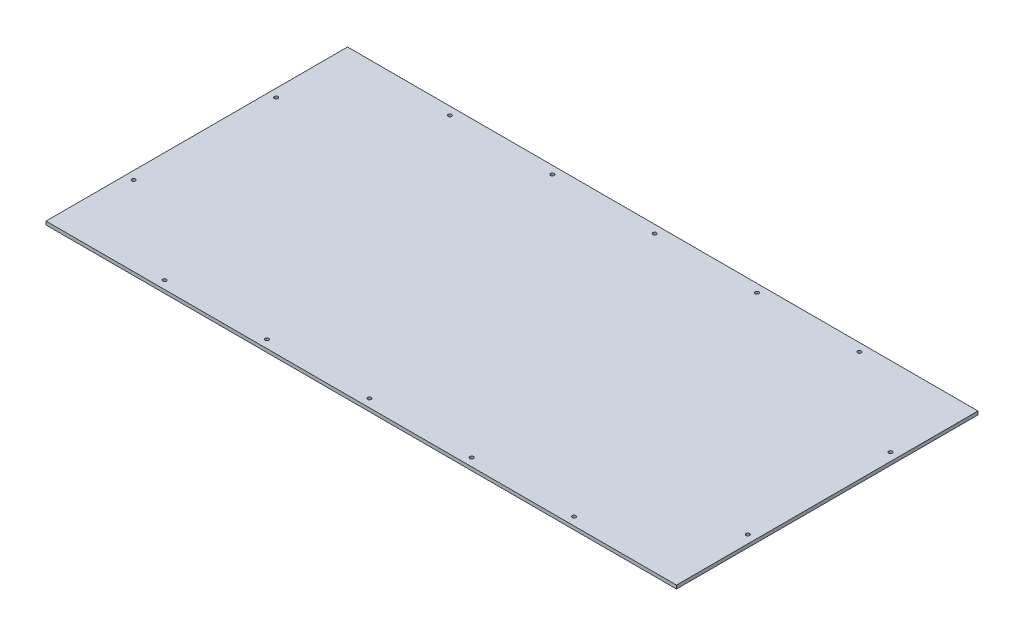
from build123d import *

# Parameters (mm, degrees)
SKETCH1_W           = 584.2
SKETCH1_H           = 279.4
SKETCH1_R           = 1.65
BOSS_EXTRUDE1_DEPTH = 3.175


with BuildPart() as part:
    # Sketch1 → Boss-Extrude1 (new body)
    with BuildSketch(Plane(origin=(0, 0, 0), x_dir=(1, 0, 0), z_dir=(0, 1, 0))):
        Rectangle(SKETCH1_W, SKETCH1_H)
        with Locations(Location((-284.6, 66.1, 0), (0, 0, 270))):
            Circle(SKETCH1_R, mode=Mode.SUBTRACT)
        with Locations(Location((-189.733333333, 132.2, 0), (0, 0, 270))):
            Circle(SKETCH1_R, mode=Mode.SUBTRACT)
        with Locations(Location((-94.866666667, 132.2, 0), (0, 0, 270))):
            Circle(SKETCH1_R, mode=Mode.SUBTRACT)
        with Locations(Location((-284.6, -66.1, 0), (0, 0, 90))):
            Circle(SKETCH1_R, mode=Mode.SUBTRACT)
        with Locations(Location((-94.866666667, -132.2, 0), (0, 0, 90))):
            Circle(SKETCH1_R, mode=Mode.SUBTRACT)
        with Locations(Location((-189.733333333, -132.2, 0), (0, 0, 90))):
            Circle(SKETCH1_R, mode=Mode.SUBTRACT)
        with Locations(Location((189.733333333, -132.2, 0), (0, 0, 270))):
            Circle(SKETCH1_R, mode=Mode.SUBTRACT)
        with Locations(Location((94.866666667, -132.2, 0), (0, 0, 270))):
            Circle(SKETCH1_R, mode=Mode.SUBTRACT)
        with Locations(Location((94.866666667, 132.2, 0), (0, 0, 90))):
            Circle(SKETCH1_R, mode=Mode.SUBTRACT)
        with Locations(Location((189.733333333, 132.2, 0), (0, 0, 90))):
            Circle(SKETCH1_R, mode=Mode.SUBTRACT)
        with Locations(Location((284.6, -66.1, 0), (0, 0, 270))):
            Circle(SKETCH1_R, mode=Mode.SUBTRACT)
        with Locations(Location((284.6, 66.1, 0), (0, 0, 90))):
            Circle(SKETCH1_R, mode=Mode.SUBTRACT)
        with Locations(Location((0, 132.2, 0), (0, 0, 270))):
            Circle(SKETCH1_R, mode=Mode.SUBTRACT)
        with Locations(Location((0, -132.2, 0), (0, 0, 270))):
            Circle(SKETCH1_R, mode=Mode.SUBTRACT)
    extrude(amount=BOSS_EXTRUDE1_DEPTH)


solid = part.part
